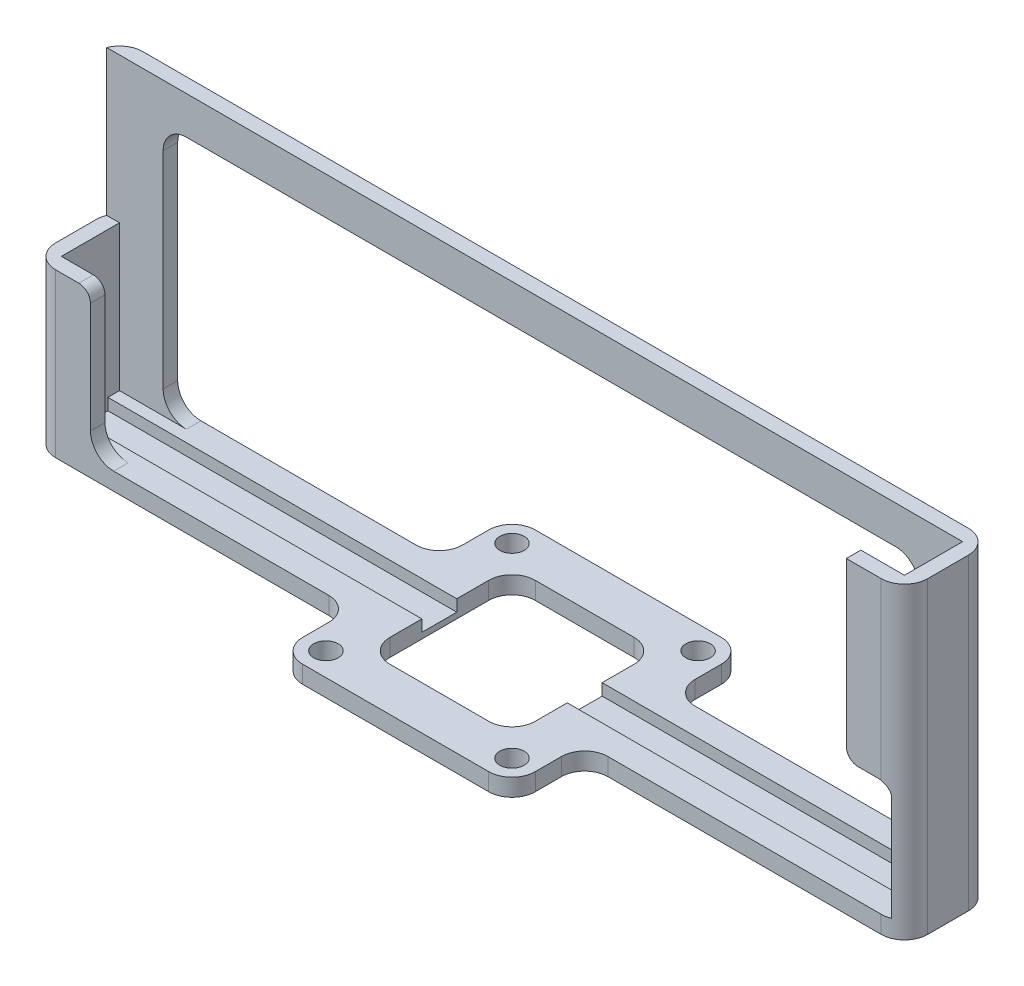
from build123d import *

# Parameters (mm, degrees)
BOSS_EXTRUDE1_DEPTH   = 50
BOSS_EXTRUDE1_2_DEPTH = 50
SKETCH2_W             = 130
SKETCH2_H             = 6.504238827
BOSS_EXTRUDE2_DEPTH   = 2.5
SKETCH4_R             = 2.1
SKETCH4_W             = 25
SKETCH4_H             = 25
BOSS_EXTRUDE4_DEPTH   = 3
FILLET1_R             = 4
SKETCH5_W             = 145
SKETCH5_H             = 6
CUT_EXTRUDE1_DEPTH    = 2
CUT_EXTRUDE2_DEPTH    = 5
SKETCH7_W             = 4.152825608
SKETCH7_H             = 25.088924328
CUT_EXTRUDE3_DEPTH    = 15
SKETCH8_W             = 11.5
SKETCH8_H             = 20
CUT_EXTRUDE5_DEPTH    = 5
FILLET2_R             = 2


with BuildPart() as part:
    # Sketch1 → Boss-Extrude1 (new body)
    with BuildSketch(Plane(origin=(0, 0, 0), x_dir=(1, 0, 0), z_dir=(0, 1, 0))):
        Polygon((-65, 5), (-65, 7.5), (-75, 7.5), (-75, -7.5), (-65, -7.5), (-65, -5), (-72.5, -5), (-72.5, 5), align=None)
    extrude(amount=BOSS_EXTRUDE1_DEPTH)



with BuildPart() as body_2:
    # Sketch1 → Boss-Extrude1 2 (new body)
    with BuildSketch(Plane(origin=(0, 0, 0), x_dir=(1, 0, 0), z_dir=(0, 1, 0))):
        Polygon((72.5, -5), (72.5, 5), (65, 5), (65, 7.5), (75, 7.5), (75, -7.5), (65, -7.5), (65, -5), align=None)
    extrude(amount=BOSS_EXTRUDE1_2_DEPTH)


with BuildPart() as part_1:
    add(part.part)

    add(body_2.part)  # Boss-Extrude2 merges body 2
    # Sketch2 → Boss-Extrude2 (add)
    with BuildSketch(Plane(origin=(0, 0, -7.5), x_dir=(-1, 0, 0), z_dir=(0, 0, -1))):
        with Locations((0, 46.747880587)):
            Rectangle(SKETCH2_W, SKETCH2_H)
    extrude(amount=-BOSS_EXTRUDE2_DEPTH)

    # Sketch4 → Boss-Extrude4 (add)
    with BuildSketch(Plane.XZ):
        Polygon((20, 7.5), (75, 7.5), (75, -7.5), (20, -7.5), (20, -20), (-20, -20), (-20, -7.5), (-75, -7.5), (-75, 7.5), (-20, 7.5), (-20, 20), (20, 20), align=None)
        with Locations(Location((16.001061443, 16.001061443, 0), (0, 0, 270))):
            Circle(SKETCH4_R, mode=Mode.SUBTRACT)
        with Locations(Location((-16, 16, 0), (0, 0, 270))):
            Circle(SKETCH4_R, mode=Mode.SUBTRACT)
        with Locations(Location((-16, -16, 0), (0, 0, 270))):
            Circle(SKETCH4_R, mode=Mode.SUBTRACT)
        with Locations(Location((16, -16, 0), (0, 0, 270))):
            Circle(SKETCH4_R, mode=Mode.SUBTRACT)
        with Locations((0.000530722, 0.000530722)):
            Rectangle(SKETCH4_W, SKETCH4_H, mode=Mode.SUBTRACT)
    extrude(amount=BOSS_EXTRUDE4_DEPTH)

    # Fillet1
    fillet1_edges = [part_1.edges().sort_by_distance(p)[0] for p in [
        (65, 0, 6.25),
        (75, 23.5, -7.5),
        (75, 23.5, 7.5),
        (65, 43.495761173, -6.25),
        (-65, 43.495761173, -6.25),
        (-65, 0, -6.25),
        (-75, 23.5, -7.5),
        (-75, 23.5, 7.5),
        (-65, 0, 6.25),
        (-20, -1.5, 7.5),
        (-20, -1.5, -7.5),
        (-20, -1.5, -20),
        (20, -1.5, -20),
        (20, -1.5, -7.5),
        (20, -1.5, 7.5),
        (20, -1.5, 20),
        (-20, -1.5, 20),
        (12.500530722, -1.5, 12.500530722),
        (-12.499469278, -1.5, 12.500530722),
        (-12.499469278, -1.5, -12.499469278),
        (12.500530722, -1.5, -12.499469278),
        (65, 0, -6.25),
    ]]
    fillet(fillet1_edges, radius=FILLET1_R)

    # Sketch5 → Cut-Extrude1 (cut)
    with BuildSketch(Plane(origin=(0, 0, 0), x_dir=(1, 0, 0), z_dir=(0, 1, 0))):
        Rectangle(SKETCH5_W, SKETCH5_H)
    extrude(amount=-CUT_EXTRUDE1_DEPTH, mode=Mode.SUBTRACT)

    # Sketch6 → Cut-Extrude2 (cut)
    with BuildSketch(Plane(origin=(-72.5, 0, 0), x_dir=(0, 0, -1), z_dir=(1, 0, 0))):
        Polygon((-14.532801633, 51.358122402), (-14.532801633, 25), (-5, 25), (5, 25), (5, 51.358122402), align=None)
    extrude(amount=-CUT_EXTRUDE2_DEPTH, mode=Mode.SUBTRACT)

    # Sketch7 → Cut-Extrude3 (cut)
    with BuildSketch(Plane.ZY.offset(72.5)):
        with Locations((7.076412804, 37.544462164)):
            Rectangle(SKETCH7_W, SKETCH7_H)
    extrude(amount=-CUT_EXTRUDE3_DEPTH, mode=Mode.SUBTRACT)

    # Sketch8 → Cut-Extrude5 (cut)
    with BuildSketch(Plane.XY.offset(7.5)):
        with Locations((66.75, 10)):
            Rectangle(SKETCH8_W, SKETCH8_H)
    extrude(amount=-CUT_EXTRUDE5_DEPTH, mode=Mode.SUBTRACT)

    # Fillet2
    fillet2_edges = [part_1.edges().sort_by_distance(p)[0] for p in [
        (72.5, 20, 6.104049622),
        (-65, 25, 6.25),
        (65, 20, 6.25),
    ]]
    fillet(fillet2_edges, radius=FILLET2_R)


solid = part_1.part
